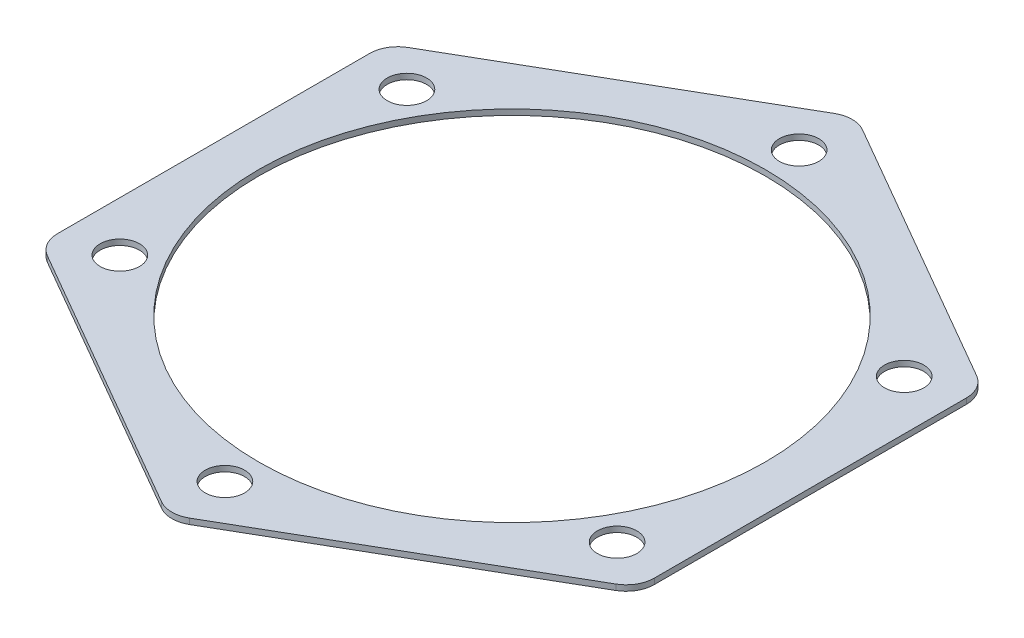
from build123d import *

# Parameters (mm, degrees)
SKETCH1_R           = 45
SKETCH1_R_2         = 3.5
BOSS_EXTRUDE1_DEPTH = 1


with BuildPart() as part:
    # Sketch1 → Boss-Extrude1 (new body)
    with BuildSketch(Plane(origin=(0, 0, 0), x_dir=(1, 0, 0), z_dir=(0, 1, 0))):
        with BuildLine():
            Line((2.5, -59.755752861), (50.5, -32.04293994))
            ThreePointArc((50.5, -32.04293994), (52.330127019, -30.212812921), (53, -27.712812921))
            Line((53, -27.712812921), (53, 27.712812921))
            ThreePointArc((53, 27.712812921), (52.330127019, 30.212812921), (50.5, 32.04293994))
            Line((50.5, 32.04293994), (2.5, 59.755752861))
            ThreePointArc((2.5, 59.755752861), (0, 60.425625842), (-2.5, 59.755752861))
            Line((-2.5, 59.755752861), (-50.5, 32.04293994))
            ThreePointArc((-50.5, 32.04293994), (-52.330127019, 30.212812921), (-53, 27.712812921))
            Line((-53, 27.712812921), (-53, -27.712812921))
            ThreePointArc((-53, -27.712812921), (-52.330127019, -30.212812921), (-50.5, -32.04293994))
            Line((-50.5, -32.04293994), (-2.5, -59.755752861))
            ThreePointArc((-2.5, -59.755752861), (0, -60.425625842), (2.5, -59.755752861))
        make_face()
        with Locations(Location((0, 0, 0), (0, 0, 270))):
            Circle(SKETCH1_R, mode=Mode.SUBTRACT)
        with Locations(Location((0, 51, 0), (0, 0, 270))):
            Circle(SKETCH1_R_2, mode=Mode.SUBTRACT)
        with Locations(Location((44.167295593, 25.5, 0), (0, 0, 270))):
            Circle(SKETCH1_R_2, mode=Mode.SUBTRACT)
        with Locations(Location((44.167295593, -25.5, 0), (0, 0, 270))):
            Circle(SKETCH1_R_2, mode=Mode.SUBTRACT)
        with Locations(Location((0, -51, 0), (0, 0, 270))):
            Circle(SKETCH1_R_2, mode=Mode.SUBTRACT)
        with Locations(Location((-44.167295593, -25.5, 0), (0, 0, 270))):
            Circle(SKETCH1_R_2, mode=Mode.SUBTRACT)
        with Locations(Location((-44.167295593, 25.5, 0), (0, 0, 270))):
            Circle(SKETCH1_R_2, mode=Mode.SUBTRACT)
    extrude(amount=BOSS_EXTRUDE1_DEPTH)


solid = part.part
